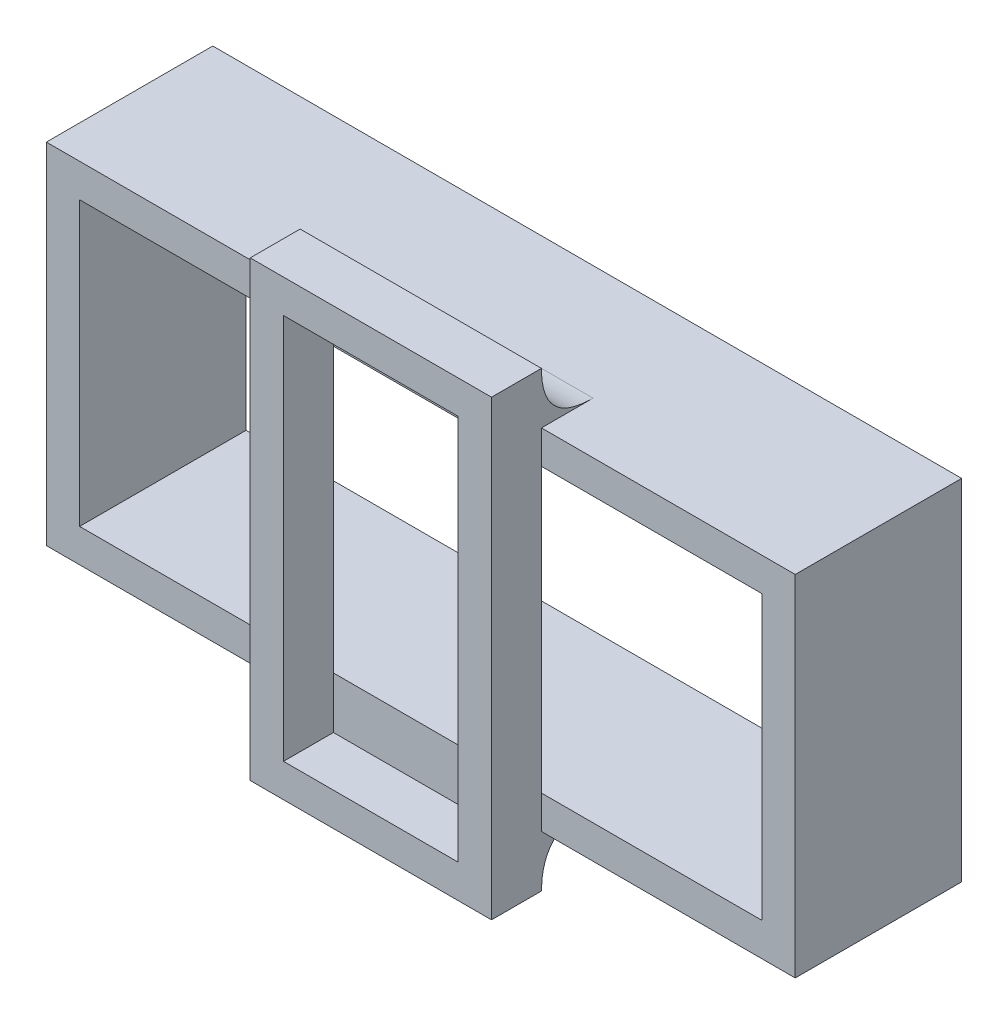
from build123d import *

# Parameters (mm, degrees)
SZKIC1_W                    = 45
SZKIC1_H                    = 21
SZKIC1_W_2                  = 41
SZKIC1_H_2                  = 17
DODANIE_WYCI_GNI_CIE1_DEPTH = 10
SZKIC2_W                    = 14.5
SZKIC2_H                    = 27.2
SZKIC2_W_2                  = 10.5
SZKIC2_H_2                  = 23.2
DODANIE_WYCI_GNI_CIE2_DEPTH = 3
DODANIE_WYCI_GNI_CIE3_START = -14.5
DODANIE_WYCI_GNI_CIE3_DEPTH = 14.5


with BuildPart() as part:
    # Szkic1 → Dodanie-wyciągnięcie1 (new body)
    with BuildSketch(Plane.XY):
        with Locations((18.754452903, 41.181022194)):
            Rectangle(SZKIC1_W, SZKIC1_H)
        with Locations((18.754452903, 41.181022194)):
            Rectangle(SZKIC1_W_2, SZKIC1_H_2, mode=Mode.SUBTRACT)
    extrude(amount=DODANIE_WYCI_GNI_CIE1_DEPTH)

    # Szkic2 → Dodanie-wyciągnięcie2 (add)
    with BuildSketch(Plane.XY.offset(10)):
        with Locations((18.754452903, 41.181022194)):
            Rectangle(SZKIC2_W, SZKIC2_H)
        with Locations((18.754452903, 41.181022194)):
            Rectangle(SZKIC2_W_2, SZKIC2_H_2, mode=Mode.SUBTRACT)
    extrude(amount=DODANIE_WYCI_GNI_CIE2_DEPTH)

    # Szkic3 → Dodanie-wyciągnięcie3 (add)
    with BuildSketch(Plane(origin=(26.004452903, 0, 0), x_dir=(0, 0, -1), z_dir=(1, 0, 0)).offset(DODANIE_WYCI_GNI_CIE3_START)):
        with BuildLine():
            Line((-10, 54.781022194), (-10, 51.681022194))
            Line((-10, 51.681022194), (-6.9, 51.681022194))
            add(Edge.make_bspline(
                [(-6.9, 51.681022194), (-10, 51.681022194), (-10, 54.781022194)],
                knots=[0, 0, 0, 1, 1, 1], degree=2))
        make_face()
        with BuildLine():
            Line((-10, 27.581022194), (-10, 30.681022194))
            Line((-10, 30.681022194), (-6.9, 30.681022194))
            add(Edge.make_bspline(
                [(-10, 27.581022194), (-10, 30.681022194), (-6.9, 30.681022194)],
                knots=[0, 0, 0, 1, 1, 1], degree=2))
        make_face()
    extrude(amount=DODANIE_WYCI_GNI_CIE3_DEPTH)


solid = part.part
